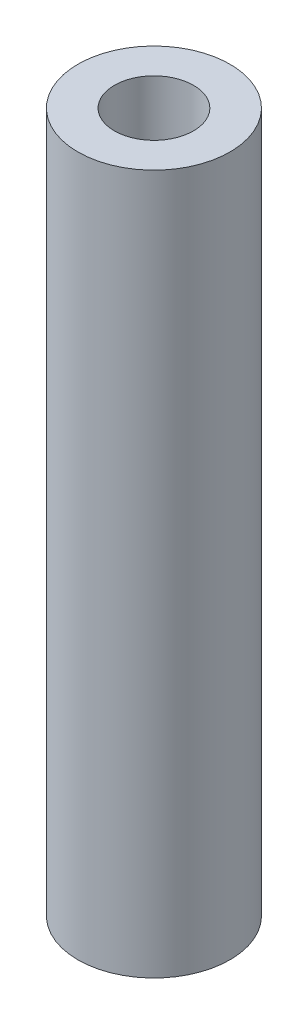
from build123d import *

# Parameters (mm, degrees)
SKETCH1_R           = 5
SKETCH1_R_2         = 2.6
BOSS_EXTRUDE1_DEPTH = 46


with BuildPart() as part:
    # Sketch1 → Boss-Extrude1 (new body)
    with BuildSketch(Plane(origin=(0, 0, 0), x_dir=(1, 0, 0), z_dir=(0, 1, 0))):
        with Locations(Location((0, 0, 0), (0, 0, 270))):
            Circle(SKETCH1_R)
        with Locations(Location((0, 0, 0), (0, 0, 270))):
            Circle(SKETCH1_R_2, mode=Mode.SUBTRACT)
    extrude(amount=BOSS_EXTRUDE1_DEPTH)


solid = part.part
